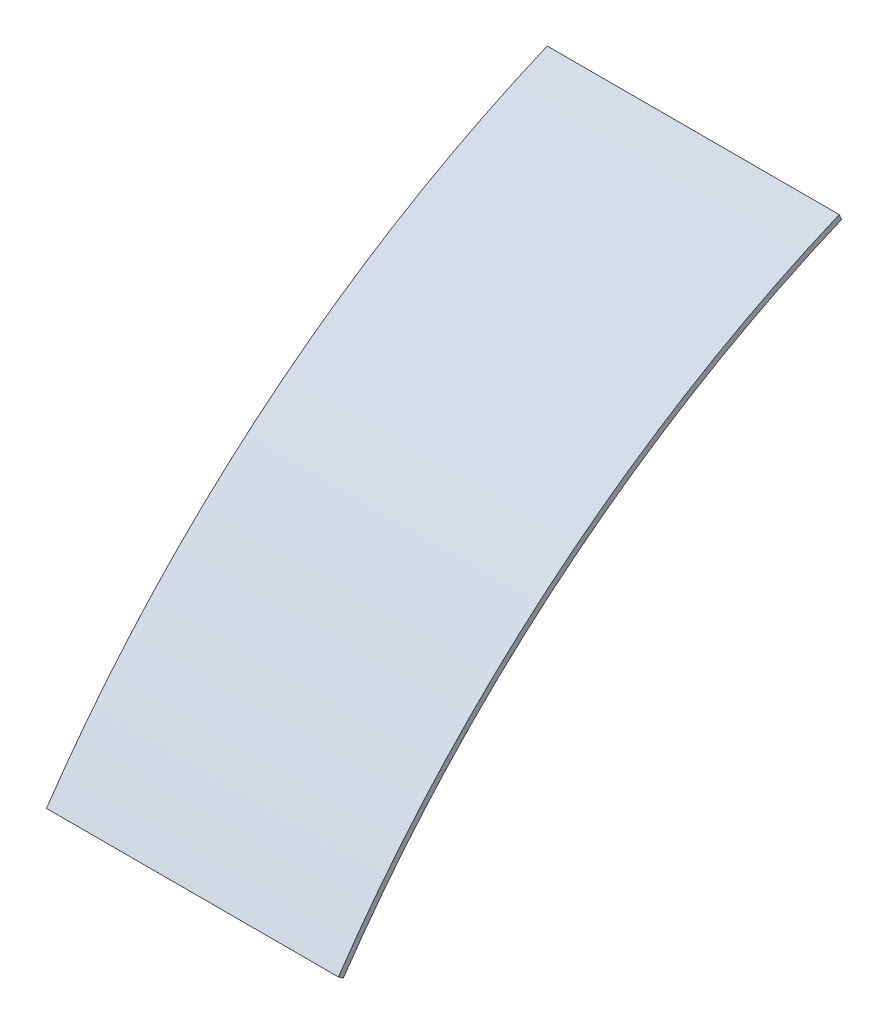
from build123d import *

# Parameters (mm, degrees)
BOSS_EXTRUDE1_DEPTH = 146.2024


with BuildPart() as part:
    # Sketch1 → Boss-Extrude1 (new body)
    with BuildSketch(Plane(origin=(0, 0, 0), x_dir=(0, 0, -1), z_dir=(1, 0, 0))):
        with BuildLine():
            Line((-249.512076162, -206.067703984), (-248.273391014, -206.911185498))
            ThreePointArc((-248.273391014, -206.911185498), (-138.30827619, -86.809936009), (1.164157607, -2.761873463))
            Line((1.164157607, -2.761873463), (0.582078803, -1.380936731))
            ThreePointArc((0.582078803, -1.380936731), (-139.257491585, -85.650284294), (-249.512076162, -206.067703984))
        make_face()
        with BuildLine():
            Line((-250.750761309, -205.22422247), (-249.512076162, -206.067703984))
            ThreePointArc((-249.512076162, -206.067703984), (-139.257491585, -85.650284294), (0.582078803, -1.380936731))
            Line((0.582078803, -1.380936731), (0, 0))
            ThreePointArc((0, 0), (-140.20670698, -84.490632578), (-250.750761309, -205.22422247))
        make_face()
    extrude(amount=BOSS_EXTRUDE1_DEPTH)


solid = part.part
